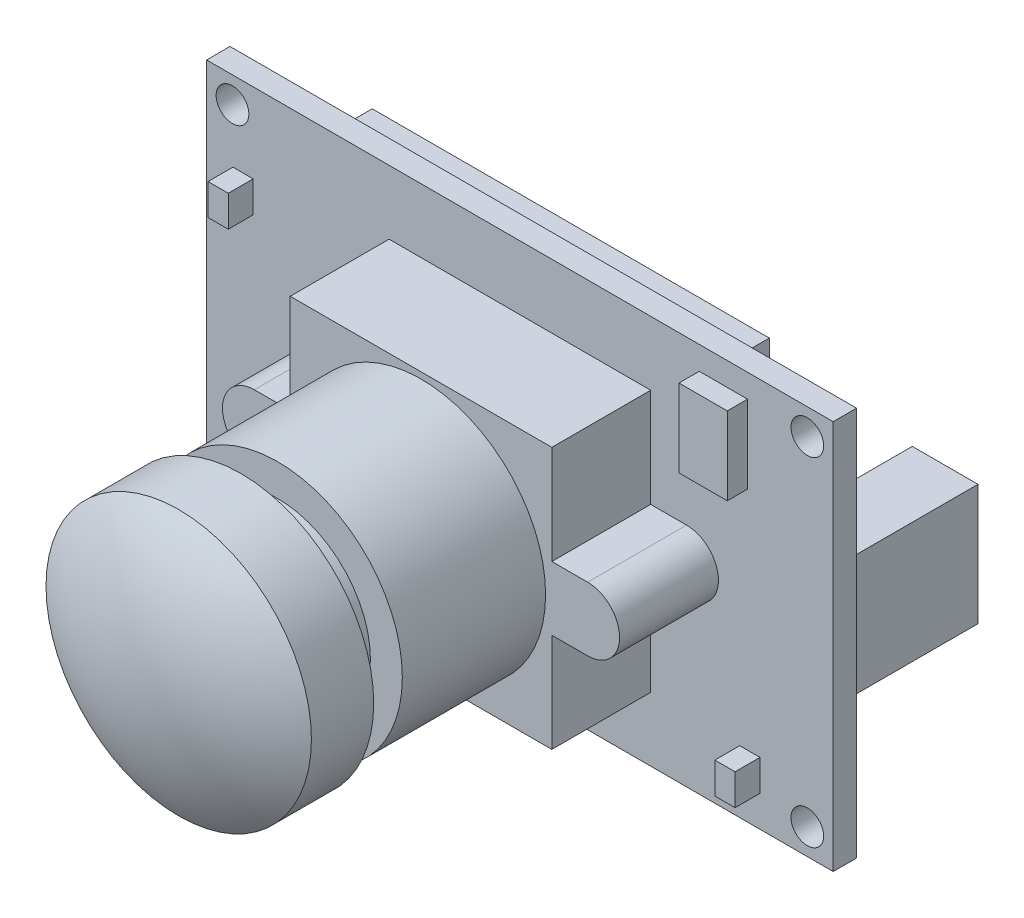
from build123d import *

# Parameters (mm, degrees)
SKETCH2_W            = 40.2336
SKETCH2_H            = 25.019
SKETCH2_R            = 1.05
BOSS_EXTRUDE1_DEPTH  = 1.5
BOSS_EXTRUDE2_DEPTH  = 6.35
SKETCH4_R            = 8
BOSS_EXTRUDE3_DEPTH  = 9.2
SKETCH5_R            = 5.95
BOSS_EXTRUDE4_DEPTH  = 2.36
SKETCH6_R            = 8.5217
LENS_DEPTH           = 4
SKETCH7_W            = 4.22
SKETCH7_H            = 7.75
BOSS_EXTRUDE6_DEPTH  = 8.3
SKETCH8_W            = 9
SKETCH8_H            = 2.93
BOSS_EXTRUDE7_DEPTH  = 4.35
SKETCH9_W            = 3.1
SKETCH9_H            = 5
BOSS_EXTRUDE8_DEPTH  = 1.3
SKETCH10_W           = 25.5
SKETCH10_H           = 8
BOSS_EXTRUDE9_DEPTH  = 1.4
SKETCH11_W           = 1.3
SKETCH11_H           = 2
BOSS_EXTRUDE10_DEPTH = 1.6
SKETCH12_W           = 3
SKETCH12_H           = 3
BOSS_EXTRUDE11_DEPTH = 1.4
SKETCH13_W           = 3.175
SKETCH13_H           = 2.6162
SKETCH13_W_2         = 8.509
SKETCH13_H_2         = 4.826
BOSS_EXTRUDE12_DEPTH = 2.7432
DOME1_FACE_RADIUS    = 8.5217
DOME1_HEIGHT         = 2.54


with BuildPart() as part:
    # Sketch2 → Boss-Extrude1 (new body)
    with BuildSketch(Plane.XY):
        Rectangle(SKETCH2_W, SKETCH2_H)
        with Locations((-18.4568, 10.8495)):
            Circle(SKETCH2_R, mode=Mode.SUBTRACT)
        with Locations(Location((-18.4568, -10.8495, 0), (0, 0, 180))):
            Circle(SKETCH2_R, mode=Mode.SUBTRACT)
        with Locations((18.4568, -10.8495)):
            Circle(SKETCH2_R, mode=Mode.SUBTRACT)
        with Locations(Location((18.4568, 10.8495, 0), (0, 0, 180))):
            Circle(SKETCH2_R, mode=Mode.SUBTRACT)
    extrude(amount=BOSS_EXTRUDE1_DEPTH)

    # Sketch3 → Boss-Extrude2 (add)
    with BuildSketch(Plane.XY.offset(1.5)):
        with BuildLine():
            Line((-8.4, -2.05), (-8.4, -8.4))
            Line((-8.4, -8.4), (8.4, -8.4))
            Line((8.4, -8.4), (8.4, -2.05))
            Line((8.4, -2.05), (10.7, -2.05))
            ThreePointArc((10.7, -2.05), (12.75, 0), (10.7, 2.05))
            Line((10.7, 2.05), (8.4, 2.05))
            Line((8.4, 2.05), (8.4, 8.4))
            Line((8.4, 8.4), (-8.4, 8.4))
            Line((-8.4, 8.4), (-8.4, 2.05))
            Line((-8.4, 2.05), (-10.7, 2.05))
            ThreePointArc((-10.7, 2.05), (-12.75, 0), (-10.7, -2.05))
            Line((-10.7, -2.05), (-8.4, -2.05))
        make_face()
    extrude(amount=BOSS_EXTRUDE2_DEPTH)

    # Sketch4 → Boss-Extrude3 (add)
    with BuildSketch(Plane.XY.offset(7.85)):
        Circle(SKETCH4_R)
    extrude(amount=BOSS_EXTRUDE3_DEPTH)

    # Sketch5 → Boss-Extrude4 (add)
    with BuildSketch(Plane.XY.offset(17.05)):
        Circle(SKETCH5_R)
    extrude(amount=BOSS_EXTRUDE4_DEPTH)

    # Sketch6 → Lens (add)
    with BuildSketch(Plane.XY.offset(19.41)):
        Circle(SKETCH6_R)
    extrude(amount=LENS_DEPTH)

    # Sketch7 → Boss-Extrude6 (add)
    with BuildSketch(Plane(origin=(0, 0, 0), x_dir=(-1, 0, 0), z_dir=(0, 0, -1))):
        with Locations((-17.5068, 0)):
            Rectangle(SKETCH7_W, SKETCH7_H)
    extrude(amount=BOSS_EXTRUDE6_DEPTH)

    # Sketch8 → Boss-Extrude7 (add)
    with BuildSketch(Plane(origin=(0, 0, 0), x_dir=(-1, 0, 0), z_dir=(0, 0, -1))):
        with Locations((11.1768, -9.4045)):
            Rectangle(SKETCH8_W, SKETCH8_H)
    extrude(amount=BOSS_EXTRUDE7_DEPTH)

    # Sketch9 → Boss-Extrude8 (add)
    with BuildSketch(Plane.XY.offset(1.5)):
        with Locations((13.0668, 8.5095)):
            Rectangle(SKETCH9_W, SKETCH9_H)
    extrude(amount=BOSS_EXTRUDE8_DEPTH)

    # Sketch10 → Boss-Extrude9 (add)
    with BuildSketch(Plane(origin=(0, 0, 0), x_dir=(-1, 0, 0), z_dir=(0, 0, -1))):
        with Locations((-0.3668, 8.2095)):
            Rectangle(SKETCH10_W, SKETCH10_H)
    extrude(amount=BOSS_EXTRUDE9_DEPTH)

    # Sketch11 → Boss-Extrude10 (add)
    with BuildSketch(Plane.XY.offset(1.5)):
        with Locations((14.7668, -9.5095)):
            Rectangle(SKETCH11_W, SKETCH11_H)
        with Locations((-17.777092667, 6.391636208)):
            Rectangle(SKETCH11_W, SKETCH11_H)
    extrude(amount=BOSS_EXTRUDE10_DEPTH)

    # Sketch12 → Boss-Extrude11 (add)
    with BuildSketch(Plane(origin=(0, 0, 0), x_dir=(-1, 0, 0), z_dir=(0, 0, -1))):
        with Locations((17.6168, 6.6095)):
            Rectangle(SKETCH12_W, SKETCH12_H)
    extrude(amount=BOSS_EXTRUDE11_DEPTH)

    # Sketch13 → Boss-Extrude12 (add)
    with BuildSketch(Plane(origin=(0, 0, 0), x_dir=(-1, 0, 0), z_dir=(0, 0, -1))):
        with Locations((-12.5603, -10.6934)):
            Rectangle(SKETCH13_W, SKETCH13_H)
        with Locations((-2.9083, -9.5885)):
            Rectangle(SKETCH13_W_2, SKETCH13_H_2)
    extrude(amount=BOSS_EXTRUDE12_DEPTH)

    # Dome1: a dome of height H over a round flat face of radius A is a cap of a sphere of radius (A * A + H * H) / (2 * H)
    dome1_r = (DOME1_FACE_RADIUS * DOME1_FACE_RADIUS + DOME1_HEIGHT * DOME1_HEIGHT) / (2 * DOME1_HEIGHT)
    dome1_base = Plane((0, 0, 23.41), z_dir=(0, 0, 1))
    with Locations(dome1_base.offset(DOME1_HEIGHT - dome1_r)):
        dome1_ball = Sphere(dome1_r, mode=Mode.PRIVATE)
    add(split(dome1_ball, bisect_by=dome1_base, keep=Keep.TOP, mode=Mode.PRIVATE))


solid = part.part
